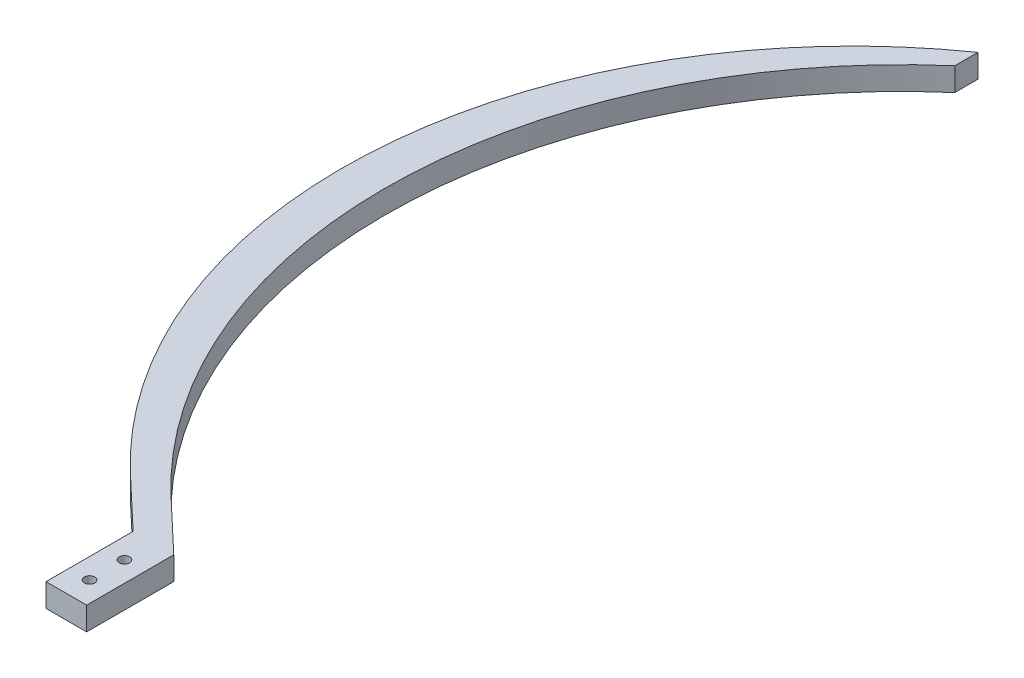
from build123d import *

# Parameters (mm, degrees)
EXTRUDE_1_DEPTH     = 4
SKETCH_5_R          = 0.9
CUT_EXTRUDE_1_DEPTH = 10


with BuildPart() as part:
    # 草图1 → 凸台-拉伸1 (new body)
    with BuildSketch(Plane(origin=(0, 0, 0), x_dir=(1, 0, 0), z_dir=(0, 1, 0))):
        with BuildLine():
            Line((3.5, 7.5), (3.5, -7.5))
            Line((3.5, -7.5), (-3.5, -7.5))
            Line((-3.5, -7.5), (-3.5, 7.5))
            Line((-3.5, 7.5), (-12.209915195, 15.754536771))
            ThreePointArc((-12.209915195, 15.754536771), (-39.438437854, 86.09778223), (-2.187829675, 151.687086375))
            Line((-2.187829675, 151.687086375), (-2.187829675, 147.687086375))
            ThreePointArc((-2.187829675, 147.687086375), (-32.965427594, 82.391199834), (-5.209915195, 15.754536771))
            Line((-5.209915195, 15.754536771), (3.5, 7.5))
        make_face()
    extrude(amount=EXTRUDE_1_DEPTH)

    # 草图5 → 切除-拉伸1 (cut)
    with BuildSketch(Plane(origin=(0, 4, 0), x_dir=(1, 0, 0), z_dir=(0, 1, 0))):
        with Locations(Location((0, -3.5, 0), (0, 0, 270))):
            Circle(SKETCH_5_R)
        with Locations(Location((0, 2.5, 0), (0, 0, 270))):
            Circle(SKETCH_5_R)
    extrude(amount=-CUT_EXTRUDE_1_DEPTH, mode=Mode.SUBTRACT)


solid = part.part
